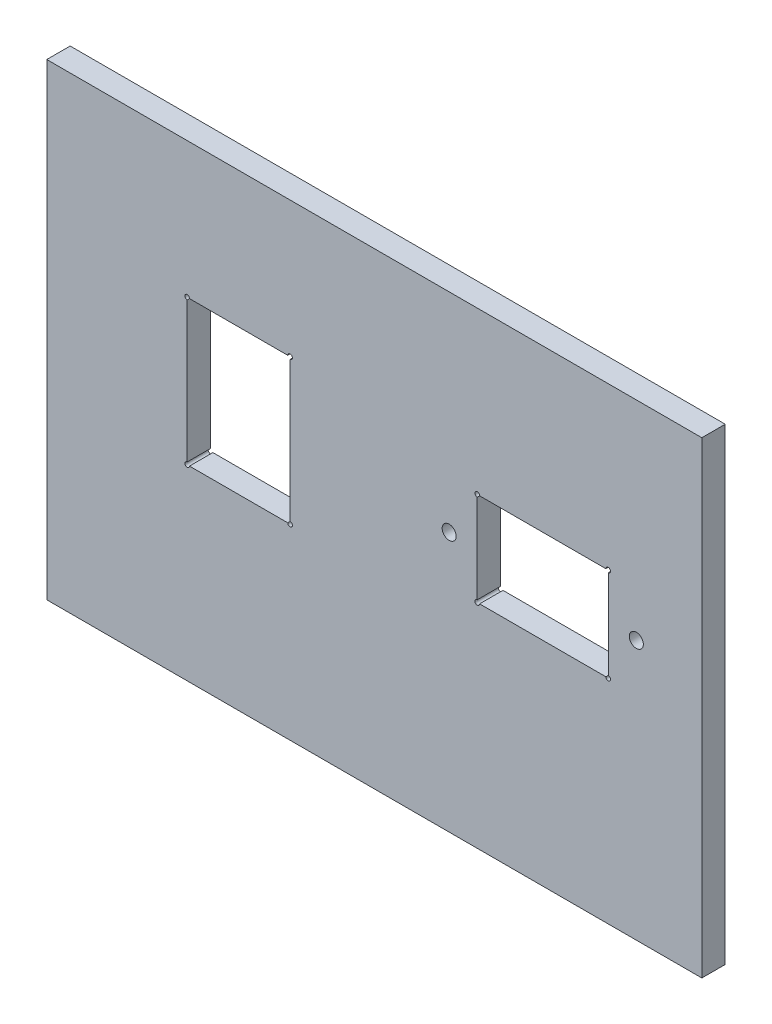
from build123d import *

# Parameters (mm, degrees)
SKIZZE1_W                       = 140
SKIZZE1_H                       = 100
AUFSATZ_LINEAR_AUSTRAGEN1_DEPTH = 5
SKIZZE2_W                       = 22
SKIZZE2_H                       = 31
SCHNITT_LINEAR_AUSTRAGEN1_DEPTH = 87.168439698
SKIZZE4_R                       = 1.5
SKIZZE4_W                       = 28
SKIZZE4_H                       = 20
SCHNITT_LINEAR_AUSTRAGEN3_DEPTH = 87.168439698
SKIZZE3_R                       = 0.5
SCHNITT_LINEAR_AUSTRAGEN2_DEPTH = 87.168439698


with BuildPart() as part:
    # Skizze1 → Aufsatz-Linear austragen1 (new body)
    with BuildSketch(Plane.XY):
        Rectangle(SKIZZE1_W, SKIZZE1_H)
    extrude(amount=AUFSATZ_LINEAR_AUSTRAGEN1_DEPTH)

    # Skizze2 → Schnitt-Linear austragen1 (cut, through all)
    with BuildSketch(Plane.XY.offset(5)):
        with Locations((-29, 5.5)):
            Rectangle(SKIZZE2_W, SKIZZE2_H)
    extrude(amount=-SCHNITT_LINEAR_AUSTRAGEN1_DEPTH, mode=Mode.SUBTRACT)

    # Skizze4 → Schnitt-Linear austragen3 (cut, through all)
    with BuildSketch(Plane.XY.offset(5)):
        with Locations((16, 5.5)):
            Circle(SKIZZE4_R)
        with Locations((56, 5.5)):
            Circle(SKIZZE4_R)
        with Locations((36, 5.5)):
            Rectangle(SKIZZE4_W, SKIZZE4_H)
    extrude(amount=-SCHNITT_LINEAR_AUSTRAGEN3_DEPTH, mode=Mode.SUBTRACT)

    # Skizze3 → Schnitt-Linear austragen2 (cut, through all)
    with BuildSketch(Plane.XY.offset(5)):
        with Locations((-40, 21)):
            Circle(SKIZZE3_R)
        with Locations((-18, 21)):
            Circle(SKIZZE3_R)
        with Locations((-18, -10)):
            Circle(SKIZZE3_R)
        with Locations((-40, -10)):
            Circle(SKIZZE3_R)
        with Locations((22, 15.5)):
            Circle(SKIZZE3_R)
        with Locations((50, 15.5)):
            Circle(SKIZZE3_R)
        with Locations((50, -4.5)):
            Circle(SKIZZE3_R)
        with Locations((22, -4.5)):
            Circle(SKIZZE3_R)
    extrude(amount=-SCHNITT_LINEAR_AUSTRAGEN2_DEPTH, mode=Mode.SUBTRACT)


solid = part.part
